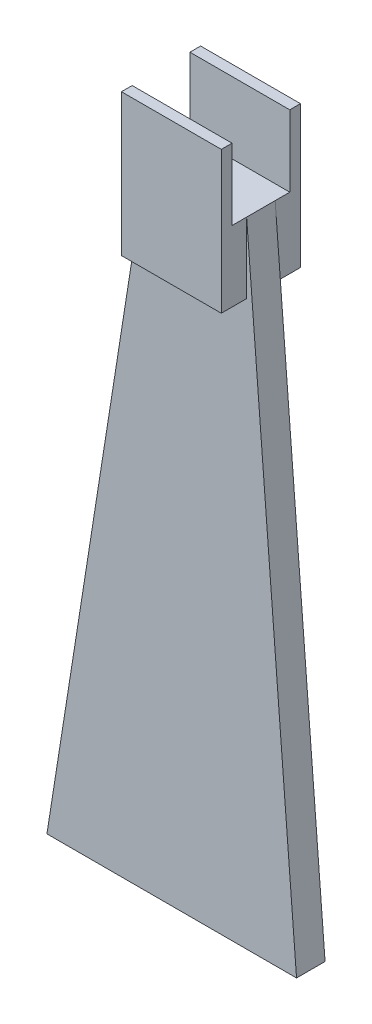
from build123d import *

# Parameters (mm, degrees)
BOSS_EXTRUDE1_DEPTH = 4
BOSS_EXTRUDE2_START = 158
SKETCH2_W           = 28
SKETCH2_H           = 22.2
BOSS_EXTRUDE2_DEPTH = 19.8
BOSS_EXTRUDE3_START = 177.8
SKETCH3_W           = 28
SKETCH3_H           = 3
BOSS_EXTRUDE3_DEPTH = 20


with BuildPart() as part:
    # Sketch1 → Boss-Extrude1 (new, symmetric)
    with BuildSketch(Plane.XY):
        Polygon((-115, 0), (-45, 0), (-59, 177.8), (-87, 177.8), align=None)
    extrude(amount=BOSS_EXTRUDE1_DEPTH, both=True)

    # Sketch2 → Boss-Extrude2 (add)
    with BuildSketch(Plane(origin=(0, 0, 0), x_dir=(1, 0, 0), z_dir=(0, 1, 0)).offset(BOSS_EXTRUDE2_START)):
        with Locations((-73, 0)):
            Rectangle(SKETCH2_W, SKETCH2_H)
    extrude(amount=BOSS_EXTRUDE2_DEPTH)

    # Sketch3 → Boss-Extrude3 (add)
    with BuildSketch(Plane(origin=(0, 0, 0), x_dir=(1, 0, 0), z_dir=(0, 1, 0)).offset(BOSS_EXTRUDE3_START)):
        with Locations((-73, 9.6)):
            Rectangle(SKETCH3_W, SKETCH3_H)
        with Locations((-73, -9.6)):
            Rectangle(SKETCH3_W, SKETCH3_H)
    extrude(amount=BOSS_EXTRUDE3_DEPTH)


solid = part.part
